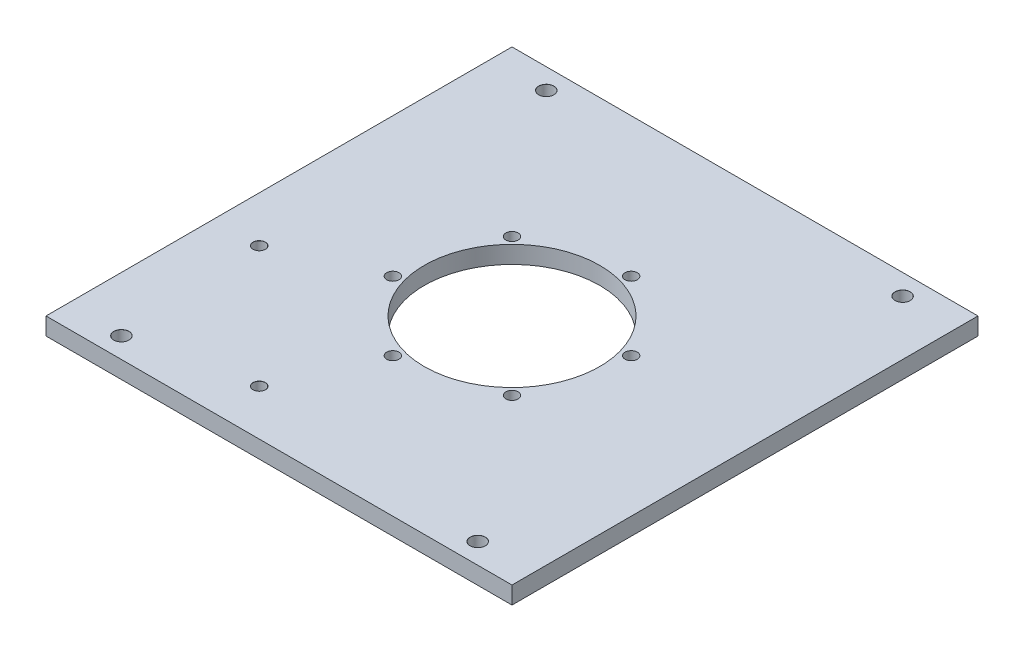
from build123d import *

# Parameters (mm, degrees)
SKETCH1_W                      = 170
SKETCH1_H                      = 170
SKETCH1_R                      = 32
BOSS_EXTRUDE3_DEPTH            = 6.35
M4_CLEARANCE_HOLE2_D           = 4.5
M4_CLEARANCE_HOLE2_CSINK_D     = 4.55
M4_CLEARANCE_HOLE2_CSINK_ANGLE = 90
M4_CLEARANCE_HOLE5_D           = 4.5
M4_CLEARANCE_HOLE5_CSINK_D     = 4.55
M4_CLEARANCE_HOLE5_CSINK_ANGLE = 90
M5_CLEARANCE_HOLE1_D           = 5.5
M5_CLEARANCE_HOLE1_CSINK_D     = 5.55
M5_CLEARANCE_HOLE1_CSINK_ANGLE = 90
M5_CLEARANCE_HOLE2_D           = 5.5
M5_CLEARANCE_HOLE2_CSINK_D     = 5.55
M5_CLEARANCE_HOLE2_CSINK_ANGLE = 90


with BuildPart() as part:
    # Sketch1 → Boss-Extrude3 (new body)
    with BuildSketch(Plane(origin=(0, 0, 0), x_dir=(1, 0, 0), z_dir=(0, 1, 0))):
        Rectangle(SKETCH1_W, SKETCH1_H)
        with Locations(Location((0, 0, 0), (0, 0, 270))):
            Circle(SKETCH1_R, mode=Mode.SUBTRACT)
    extrude(amount=BOSS_EXTRUDE3_DEPTH)

    # M4 Clearance Hole2 (through all)
    with Locations(Plane(origin=(0, 0, 0), x_dir=(-1, 0, 0), z_dir=(0, -1, 0))):
        with Locations((-9.188076101, 34.290366833), (25.102290732, 25.102290732), (34.290366833, -9.188076101), (9.188076101, -34.290366833), (-25.102290732, -25.102290732), (-34.290366833, 9.188076101)):
            CounterSinkHole(M4_CLEARANCE_HOLE2_D / 2, M4_CLEARANCE_HOLE2_CSINK_D / 2, counter_sink_angle=M4_CLEARANCE_HOLE2_CSINK_ANGLE)

    # M4 Clearance Hole5 (through all)
    with Locations(Plane(origin=(0, 6.35, 0), x_dir=(1, 0, 0), z_dir=(0, 1, 0))):
        with Locations((-68.301673362, -23.916580707), (-23.916580707, -68.301673362)):
            CounterSinkHole(M4_CLEARANCE_HOLE5_D / 2, M4_CLEARANCE_HOLE5_CSINK_D / 2, counter_sink_angle=M4_CLEARANCE_HOLE5_CSINK_ANGLE)

    # M5 Clearance Hole1 (through all)
    with Locations(Plane(origin=(0, 6.35, 0), x_dir=(1, 0, 0), z_dir=(0, 1, 0))):
        with Locations((-65, -77.5)):
            CounterSinkHole(M5_CLEARANCE_HOLE1_D / 2, M5_CLEARANCE_HOLE1_CSINK_D / 2, counter_sink_angle=M5_CLEARANCE_HOLE1_CSINK_ANGLE)

    # M5 Clearance Hole2 (through all)
    with Locations(Plane(origin=(0, 6.35, 0), x_dir=(1, 0, 0), z_dir=(0, 1, 0))):
        with Locations((-65, 77.5), (65, 77.5), (65, -77.5)):
            CounterSinkHole(M5_CLEARANCE_HOLE2_D / 2, M5_CLEARANCE_HOLE2_CSINK_D / 2, counter_sink_angle=M5_CLEARANCE_HOLE2_CSINK_ANGLE)


solid = part.part
